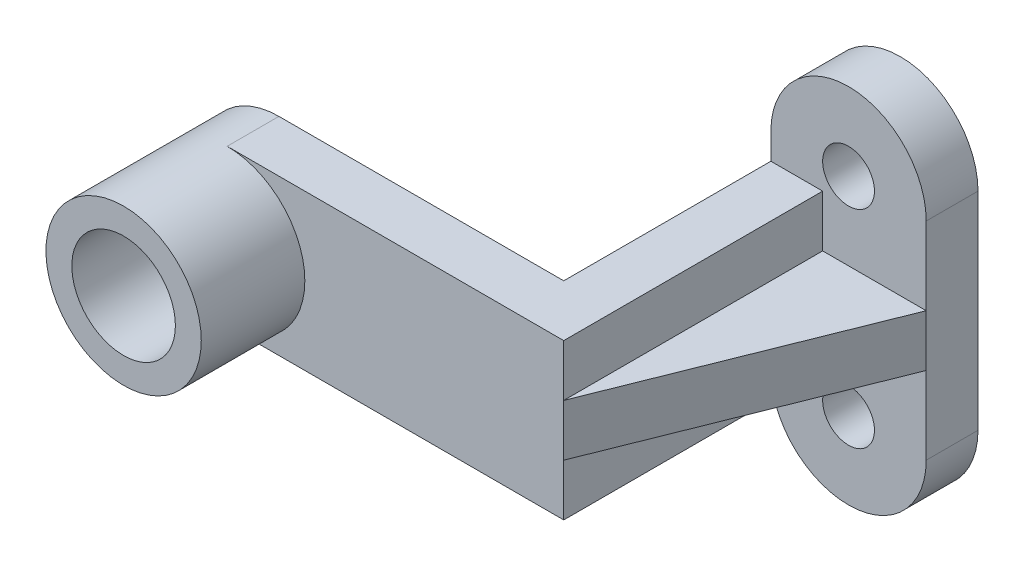
from build123d import *

# Parameters (mm, degrees)
SKETCH_1_R          = 5
EXTRUDE_1_DEPTH     = 10
SKETCH_2_W          = 20
SKETCH_2_H          = 10
EXTRUDE_2_DEPTH     = 50
CUT_EXTRUDE_1_DEPTH = 50
SKETCH_5_W          = 10
SKETCH_5_H          = 30
EXTRUDE_3_DEPTH     = 50
SKETCH_6_W          = 10
SKETCH_6_H          = 30
EXTRUDE_4_DEPTH     = 55
SKETCH_7_R          = 15
SKETCH_7_R_2        = 10
EXTRUDE_5_DEPTH     = 20
SKETCH_8_R          = 15
EXTRUDE_6_DEPTH     = 10


with BuildPart() as part:
    # 草圖1 → 填料-伸長1 (new body)
    with BuildSketch(Plane.XY):
        with BuildLine():
            Line((15, 20), (15, -20))
            ThreePointArc((15, -20), (0, -35), (-15, -20))
            Line((-15, -20), (-15, 20))
            ThreePointArc((-15, 20), (0, 35), (15, 20))
        make_face()
        with Locations((0, -20)):
            Circle(SKETCH_1_R, mode=Mode.SUBTRACT)
        with Locations((0, 20)):
            Circle(SKETCH_1_R, mode=Mode.SUBTRACT)
    extrude(amount=EXTRUDE_1_DEPTH)

    # 草圖2 → 填料-伸長2 (add)
    with BuildSketch(Plane.XY.offset(10)):
        with Locations((5, 0)):
            Rectangle(SKETCH_2_W, SKETCH_2_H)
    extrude(amount=EXTRUDE_2_DEPTH)

    # 草圖4 → 除料-伸長1 (cut)
    with BuildSketch(Plane.XZ.offset(5)):
        Polygon((-5, 60), (15, 10), (15, 60), align=None)
    extrude(amount=-CUT_EXTRUDE_1_DEPTH, mode=Mode.SUBTRACT)

    # 草圖5 → 填料-伸長3 (add)
    with BuildSketch(Plane.XY.offset(10)):
        with Locations((-10, 0)):
            Rectangle(SKETCH_5_W, SKETCH_5_H)
    extrude(amount=EXTRUDE_3_DEPTH)

    # 草圖6 → 填料-伸長4 (add)
    with BuildSketch(Plane.ZY.offset(15)):
        with Locations((55, 0)):
            Rectangle(SKETCH_6_W, SKETCH_6_H)
    extrude(amount=EXTRUDE_4_DEPTH)

    # 草圖7 → 填料-伸長5 (add)
    with BuildSketch(Plane.XY.offset(60)):
        with Locations(Location((-70, 0, 0), (0, 0, 270))):
            Circle(SKETCH_7_R)
        with Locations(Location((-70, 0, 0), (0, 0, 90))):
            Circle(SKETCH_7_R_2, mode=Mode.SUBTRACT)
    extrude(amount=EXTRUDE_5_DEPTH)

    # 草圖8 → 填料-伸長6 (add)
    with BuildSketch(Plane(origin=(0, 0, 50), x_dir=(-1, 0, 0), z_dir=(0, 0, -1))):
        with Locations(Location((70, 0, 0), (0, 0, 90))):
            Circle(SKETCH_8_R)
    extrude(amount=-EXTRUDE_6_DEPTH)


solid = part.part
